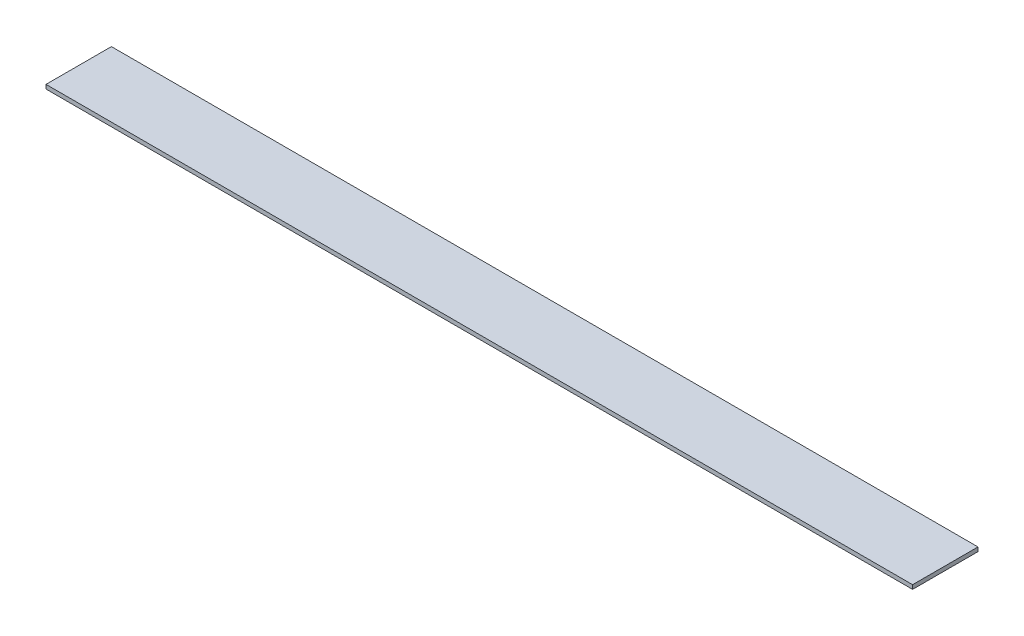
from build123d import *

# Parameters (mm, degrees)
SKETCH1_W           = 336.55
SKETCH1_H           = 25.4
BOSS_EXTRUDE1_DEPTH = 1.5875


with BuildPart() as part:
    # Sketch1 → Boss-Extrude1 (new body)
    with BuildSketch(Plane(origin=(0, 0, 0), x_dir=(1, 0, 0), z_dir=(0, 1, 0))):
        with Locations((168.275, 12.7)):
            Rectangle(SKETCH1_W, SKETCH1_H)
    extrude(amount=BOSS_EXTRUDE1_DEPTH)


solid = part.part
